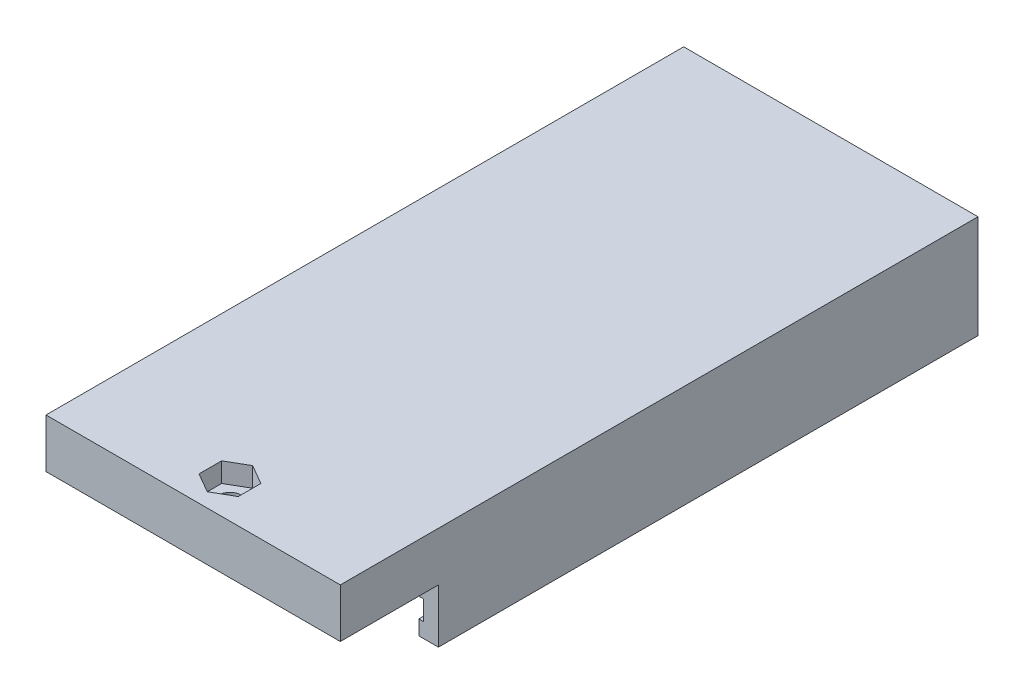
from build123d import *

# Parameters (mm, degrees)
EXTRUDE_1_DEPTH     = 105
SKETCH_2_W          = 4
SKETCH_2_H          = 105
EXTRUDE_2_DEPTH     = 3
SKETCH_4_W          = 60
SKETCH_4_H          = 11
EXTRUDE_3_DEPTH     = 5
SKETCH_6_W          = 60
SKETCH_6_H          = 110
SKETCH_6_H_2        = 20
EXTRUDE_4_DEPTH     = 10
CUT_EXTRUDE_1_DEPTH = 4
SKETCH_9_R          = 2.25
CUT_EXTRUDE_2_DEPTH = 139.430487971


with BuildPart() as part:
    # 스케치1 → 보스-돌출1 (new body)
    with BuildSketch(Plane.XY):
        Polygon((-3, 0), (0, 0), (0, 4), (54, 4), (54, 0), (57, 0), (57, 8), (-3, 8), align=None)
    extrude(amount=EXTRUDE_1_DEPTH)

    # 스케치2 → 보스-돌출2 (add)
    with BuildSketch(Plane.XZ):
        with Locations((-1, 52.5)):
            Rectangle(SKETCH_2_W, SKETCH_2_H)
        with Locations((55, 52.5)):
            Rectangle(SKETCH_2_W, SKETCH_2_H)
    extrude(amount=EXTRUDE_2_DEPTH)

    # 스케치4 → 보스-돌출3 (add)
    with BuildSketch(Plane(origin=(0, 0, 0), x_dir=(-1, 0, 0), z_dir=(0, 0, -1))):
        with Locations((-27, 2.5)):
            Rectangle(SKETCH_4_W, SKETCH_4_H)
    extrude(amount=EXTRUDE_3_DEPTH)

    # 스케치6 → 보스-돌출4 (add)
    with BuildSketch(Plane(origin=(0, 8, 0), x_dir=(1, 0, 0), z_dir=(0, 1, 0))):
        with Locations((27, -50)):
            Rectangle(SKETCH_6_W, SKETCH_6_H)
        with Locations((27, -115)):
            Rectangle(SKETCH_6_W, SKETCH_6_H_2)
    extrude(amount=EXTRUDE_4_DEPTH)

    # 스케치8 → 컷-돌출1 (cut)
    with BuildSketch(Plane(origin=(0, 18, 0), x_dir=(1, 0, 0), z_dir=(0, 1, 0))):
        Polygon((23, -115.190598923), (23, -119.809401077), (27, -122.118802154), (31, -119.809401077), (31, -115.190598923), (27, -112.881197846), align=None)
    extrude(amount=-CUT_EXTRUDE_1_DEPTH, mode=Mode.SUBTRACT)

    # 스케치9 → 컷-돌출2 (cut, through all)
    with BuildSketch(Plane(origin=(0, 14, 0), x_dir=(1, 0, 0), z_dir=(0, 1, 0))):
        with Locations(Location((27, -117.5, 0), (0, 0, 270))):
            Circle(SKETCH_9_R)
    extrude(amount=-CUT_EXTRUDE_2_DEPTH, mode=Mode.SUBTRACT)


solid = part.part
